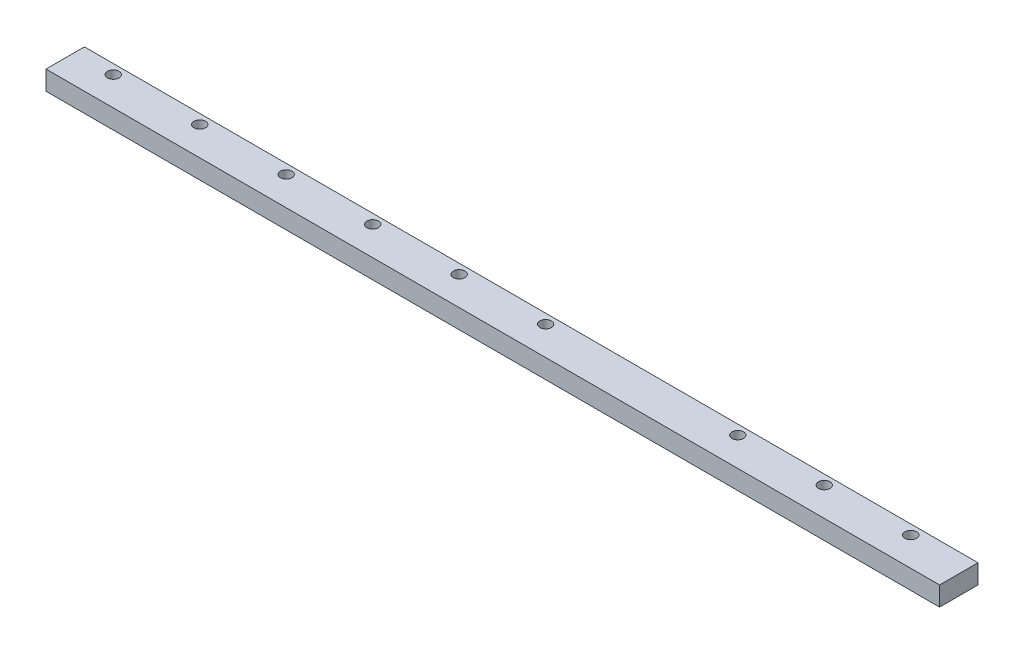
from build123d import *

# Parameters (mm, degrees)
SKETCH1_W                     = 590.55
SKETCH1_H                     = 25.4
BOSS_EXTRUDE1_DEPTH           = 12.7
F_94_0_3_DIAMETER_HOLE1_D     = 7.62
F_94_0_3_DIAMETER_HOLE1_DEPTH = 12.7
F_94_0_3_DIAMETER_HOLE1_TIP   = 2.289278958


with BuildPart() as part:
    # Sketch1 → Boss-Extrude1 (new body)
    with BuildSketch(Plane(origin=(0, 0, 0), x_dir=(1, 0, 0), z_dir=(0, 1, 0))):
        Rectangle(SKETCH1_W, SKETCH1_H)
    extrude(amount=BOSS_EXTRUDE1_DEPTH)

    # #94 (0.3) Diameter Hole1
    with Locations(Plane(origin=(0, 12.7, 0), x_dir=(1, 0, 0), z_dir=(0, 1, 0))):
        with Locations((-269.875, 6.35), (-212.725, 6.35), (142.875, 6.35), (-155.575, 6.35), (-98.425, 6.35), (-41.275, 6.35), (15.875, 6.35), (200.025, 6.35), (257.175, 6.35)):
            Hole(F_94_0_3_DIAMETER_HOLE1_D / 2, depth=F_94_0_3_DIAMETER_HOLE1_DEPTH)
            with Locations((0, 0, -(F_94_0_3_DIAMETER_HOLE1_DEPTH + F_94_0_3_DIAMETER_HOLE1_TIP / 2))):  # 118° drill point
                Cone(0, F_94_0_3_DIAMETER_HOLE1_D / 2, F_94_0_3_DIAMETER_HOLE1_TIP, mode=Mode.SUBTRACT)


solid = part.part
